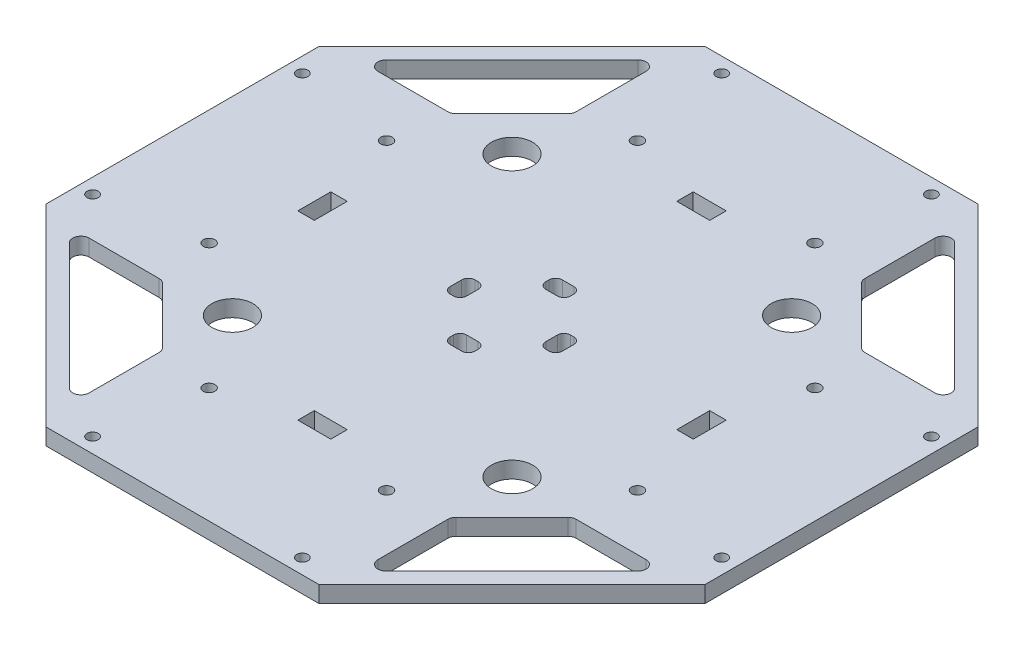
from build123d import *

# Parameters (mm, degrees)
BASE_DEPTH                   = 6.35
SUPPORT_CUTOUTS_REACH        = 181.717
SKETCH4_W                    = 12.7
SKETCH4_H                    = 6.35
SUPPORT_CUTOUT_PATTERN_COUNT = 4
F_8_CLEARANCE_HOLE1_D        = 4.4958
CABLE_HOLES_REACH            = 181.717
SKETCH14_R                   = 7.9375
ALIGNER_MOUNTING_HOLES_D     = 4.3053
CIRPATTERN1_COUNT            = 4
CUT_EXTRUDE2_DEPTH           = 180.717340566
CUT_EXTRUDE3_DEPTH           = 180.717340566


with BuildPart() as part:
    # Base sketch → Base (new body)
    with BuildSketch(Plane(origin=(0, 0, 0), x_dir=(1, 0, 0), z_dir=(0, 1, 0))):
        Polygon((-127, 52.605122421), (-127, -52.605122421), (-52.605122421, -127), (52.605122421, -127), (127, -52.605122421), (127, 52.605122421), (52.605122421, 127), (-52.605122421, 127), align=None)
    extrude(amount=BASE_DEPTH)

    # Sketch4 → Support cutouts (cut, up to next)
    with BuildSketch(Plane(origin=(0, 6.35, 0), x_dir=(1, 0, 0), z_dir=(0, 1, 0)), mode=Mode.PRIVATE) as support_cutouts_sk1:
        with Locations((0, 73.025)):
            Rectangle(SKETCH4_W, SKETCH4_H)
    support_cutouts_tool1 = extrude(support_cutouts_sk1.sketch, amount=-SUPPORT_CUTOUTS_REACH, mode=Mode.PRIVATE) & part.part
    support_cutouts = support_cutouts_tool1.solids().sort_by_distance((0, 6.35, -73.025))[0]
    add(support_cutouts, mode=Mode.SUBTRACT)

    # Support cutout pattern: Support cutouts ×4 about axis
    support_cutout_pattern_axis = Axis((0, -0.29972, 0), (0, 1, 0))
    for i in range(1, SUPPORT_CUTOUT_PATTERN_COUNT):
        add(support_cutouts.rotate(support_cutout_pattern_axis, i * 360 / SUPPORT_CUTOUT_PATTERN_COUNT), mode=Mode.SUBTRACT)

    # #8 Clearance Hole1 (through all)
    with Locations(Plane(origin=(0, 6.35, 0), x_dir=(1, 0, 0), z_dir=(0, 1, 0))):
        with Locations((-82.55, 34.193329574), (-34.193329574, 82.55), (34.193329574, 82.55), (82.55, 34.193329574), (82.55, -34.193329574), (34.193329574, -82.55), (-34.193329574, -82.55), (-82.55, -34.193329574)):
            Hole(F_8_CLEARANCE_HOLE1_D / 2)

    # Sketch14 → Cable holes (cut, up to next)
    with BuildSketch(Plane(origin=(0, 6.35, 0), x_dir=(1, 0, 0), z_dir=(0, 1, 0)), mode=Mode.PRIVATE) as cable_holes_sk1:
        with Locations((-53.881536726, 53.881536726)):
            Circle(SKETCH14_R)
    cable_holes_tool1 = extrude(cable_holes_sk1.sketch, amount=-CABLE_HOLES_REACH, mode=Mode.PRIVATE) & part.part
    # Sketch14 → Cable holes (cut, up to next)
    with BuildSketch(Plane(origin=(0, 6.35, 0), x_dir=(1, 0, 0), z_dir=(0, 1, 0)), mode=Mode.PRIVATE) as cable_holes_sk2:
        with Locations((53.881536726, 53.881536726)):
            Circle(SKETCH14_R)
    cable_holes_tool2 = extrude(cable_holes_sk2.sketch, amount=-CABLE_HOLES_REACH, mode=Mode.PRIVATE) & part.part
    # Sketch14 → Cable holes (cut, up to next)
    with BuildSketch(Plane(origin=(0, 6.35, 0), x_dir=(1, 0, 0), z_dir=(0, 1, 0)), mode=Mode.PRIVATE) as cable_holes_sk3:
        with Locations((53.881536726, -53.881536726)):
            Circle(SKETCH14_R)
    cable_holes_tool3 = extrude(cable_holes_sk3.sketch, amount=-CABLE_HOLES_REACH, mode=Mode.PRIVATE) & part.part
    # Sketch14 → Cable holes (cut, up to next)
    with BuildSketch(Plane(origin=(0, 6.35, 0), x_dir=(1, 0, 0), z_dir=(0, 1, 0)), mode=Mode.PRIVATE) as cable_holes_sk4:
        with Locations((-53.881536726, -53.881536726)):
            Circle(SKETCH14_R)
    cable_holes_tool4 = extrude(cable_holes_sk4.sketch, amount=-CABLE_HOLES_REACH, mode=Mode.PRIVATE) & part.part
    add(cable_holes_tool1.solids().sort_by_distance((-53.881537, 6.35, -53.881537))[0], mode=Mode.SUBTRACT)
    add(cable_holes_tool2.solids().sort_by_distance((53.881537, 6.35, -53.881537))[0], mode=Mode.SUBTRACT)
    add(cable_holes_tool3.solids().sort_by_distance((53.881537, 6.35, 53.881537))[0], mode=Mode.SUBTRACT)
    add(cable_holes_tool4.solids().sort_by_distance((-53.881537, 6.35, 53.881537))[0], mode=Mode.SUBTRACT)

    # aligner mounting holes (through all)
    with Locations(Plane(origin=(0, 6.35, 0), x_dir=(1, 0, 0), z_dir=(0, 1, 0))):
        with Locations((121.233457634, 40.411152545), (40.411152545, 121.233457634)):
            aligner_mounting_holes = Hole(ALIGNER_MOUNTING_HOLES_D / 2)

    # CirPattern1: aligner mounting holes ×4 about axis
    cirpattern1_axis = Axis((0, -0.29972, 0), (0, 1, 0))
    for i in range(1, CIRPATTERN1_COUNT):
        add(aligner_mounting_holes.rotate(cirpattern1_axis, i * 360 / CIRPATTERN1_COUNT), mode=Mode.SUBTRACT)

    # Sketch28 → Cut-Extrude2 (cut, through all)
    with BuildSketch(Plane(origin=(0, 6.35, 0), x_dir=(1, 0, 0), z_dir=(0, 1, 0))):
        with BuildLine():
            Line((55.651152545, 80.367817332), (55.651152545, 107.308585695))
            ThreePointArc((55.651152545, 107.308585695), (57.611132647, 110.241903211), (61.071216575, 109.553649725))
            Line((61.071216575, 109.553649725), (109.553649725, 61.071216575))
            ThreePointArc((109.553649725, 61.071216575), (110.241903211, 57.611132647), (107.308585695, 55.651152545))
            Line((107.308585695, 55.651152545), (80.367817332, 55.651152545))
            ThreePointArc((80.367817332, 55.651152545), (79.152797434, 55.892835029), (78.122753301, 56.581088515))
            Line((78.122753301, 56.581088515), (56.581088515, 78.122753301))
            ThreePointArc((56.581088515, 78.122753301), (55.892835029, 79.152797434), (55.651152545, 80.367817332))
        make_face()
        with BuildLine():
            Line((80.367817332, -55.651152545), (107.308585695, -55.651152545))
            ThreePointArc((107.308585695, -55.651152545), (110.241903211, -57.611132647), (109.553649725, -61.071216575))
            Line((109.553649725, -61.071216575), (61.071216575, -109.553649725))
            ThreePointArc((61.071216575, -109.553649725), (57.611132647, -110.241903211), (55.651152545, -107.308585695))
            Line((55.651152545, -107.308585695), (55.651152545, -80.367817332))
            ThreePointArc((55.651152545, -80.367817332), (55.892835029, -79.152797434), (56.581088515, -78.122753301))
            Line((56.581088515, -78.122753301), (78.122753301, -56.581088515))
            ThreePointArc((78.122753301, -56.581088515), (79.152797434, -55.892835029), (80.367817332, -55.651152545))
        make_face()
        with BuildLine():
            Line((-55.651152545, -80.367817332), (-55.651152545, -107.308585695))
            ThreePointArc((-55.651152545, -107.308585695), (-57.611132647, -110.241903211), (-61.071216575, -109.553649725))
            Line((-61.071216575, -109.553649725), (-109.553649725, -61.071216575))
            ThreePointArc((-109.553649725, -61.071216575), (-110.241903211, -57.611132647), (-107.308585695, -55.651152545))
            Line((-107.308585695, -55.651152545), (-80.367817332, -55.651152545))
            ThreePointArc((-80.367817332, -55.651152545), (-79.152797434, -55.892835029), (-78.122753301, -56.581088515))
            Line((-78.122753301, -56.581088515), (-56.581088515, -78.122753301))
            ThreePointArc((-56.581088515, -78.122753301), (-55.892835029, -79.152797434), (-55.651152545, -80.367817332))
        make_face()
        with BuildLine():
            Line((-56.581088515, 78.122753301), (-78.122753301, 56.581088515))
            ThreePointArc((-78.122753301, 56.581088515), (-79.152797434, 55.892835029), (-80.367817332, 55.651152545))
            Line((-80.367817332, 55.651152545), (-107.308585695, 55.651152545))
            ThreePointArc((-107.308585695, 55.651152545), (-110.241903211, 57.611132647), (-109.553649725, 61.071216575))
            Line((-109.553649725, 61.071216575), (-61.071216575, 109.553649725))
            ThreePointArc((-61.071216575, 109.553649725), (-57.611132647, 110.241903211), (-55.651152545, 107.308585695))
            Line((-55.651152545, 107.308585695), (-55.651152545, 80.367817332))
            ThreePointArc((-55.651152545, 80.367817332), (-55.892835029, 79.152797434), (-56.581088515, 78.122753301))
        make_face()
    extrude(amount=-CUT_EXTRUDE2_DEPTH, mode=Mode.SUBTRACT)

    # Sketch29 → Cut-Extrude3 (cut, through all)
    with BuildSketch(Plane(origin=(0, 6.35, 0), x_dir=(1, 0, 0), z_dir=(0, 1, 0))):
        with BuildLine():
            Line((15.24, -2.2225), (15.24, 2.2225))
            ThreePointArc((15.24, 2.2225), (15.983948776, 4.018551224), (17.78, 4.7625))
            Line((17.78, 4.7625), (19.05, 4.7625))
            ThreePointArc((19.05, 4.7625), (20.846051224, 4.018551224), (21.59, 2.2225))
            Line((21.59, 2.2225), (21.59, -2.2225))
            ThreePointArc((21.59, -2.2225), (20.846051224, -4.018551224), (19.05, -4.7625))
            Line((19.05, -4.7625), (17.78, -4.7625))
            ThreePointArc((17.78, -4.7625), (15.983948776, -4.018551224), (15.24, -2.2225))
        make_face()
        with BuildLine():
            Line((2.2225, 15.24), (-2.2225, 15.24))
            ThreePointArc((-2.2225, 15.24), (-4.018551224, 15.983948776), (-4.7625, 17.78))
            Line((-4.7625, 17.78), (-4.7625, 19.05))
            ThreePointArc((-4.7625, 19.05), (-4.018551224, 20.846051224), (-2.2225, 21.59))
            Line((-2.2225, 21.59), (2.2225, 21.59))
            ThreePointArc((2.2225, 21.59), (4.018551224, 20.846051224), (4.7625, 19.05))
            Line((4.7625, 19.05), (4.7625, 17.78))
            ThreePointArc((4.7625, 17.78), (4.018551224, 15.983948776), (2.2225, 15.24))
        make_face()
        with BuildLine():
            Line((-2.2225, -15.24), (2.2225, -15.24))
            ThreePointArc((2.2225, -15.24), (4.018551224, -15.983948776), (4.7625, -17.78))
            Line((4.7625, -17.78), (4.7625, -19.05))
            ThreePointArc((4.7625, -19.05), (4.018551224, -20.846051224), (2.2225, -21.59))
            Line((2.2225, -21.59), (-2.2225, -21.59))
            ThreePointArc((-2.2225, -21.59), (-4.018551224, -20.846051224), (-4.7625, -19.05))
            Line((-4.7625, -19.05), (-4.7625, -17.78))
            ThreePointArc((-4.7625, -17.78), (-4.018551224, -15.983948776), (-2.2225, -15.24))
        make_face()
        with BuildLine():
            Line((-15.24, 2.2225), (-15.24, -2.2225))
            ThreePointArc((-15.24, -2.2225), (-15.983948776, -4.018551224), (-17.78, -4.7625))
            Line((-17.78, -4.7625), (-19.05, -4.7625))
            ThreePointArc((-19.05, -4.7625), (-20.846051224, -4.018551224), (-21.59, -2.2225))
            Line((-21.59, -2.2225), (-21.59, 2.2225))
            ThreePointArc((-21.59, 2.2225), (-20.846051224, 4.018551224), (-19.05, 4.7625))
            Line((-19.05, 4.7625), (-17.78, 4.7625))
            ThreePointArc((-17.78, 4.7625), (-15.983948776, 4.018551224), (-15.24, 2.2225))
        make_face()
    extrude(amount=-CUT_EXTRUDE3_DEPTH, mode=Mode.SUBTRACT)


solid = part.part
